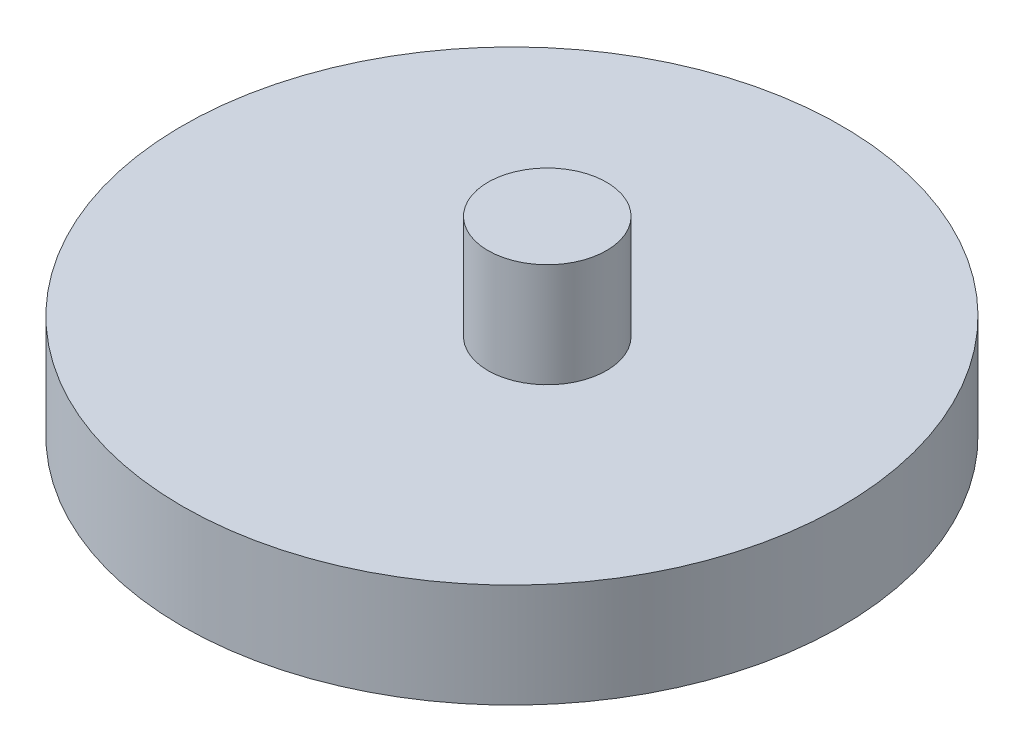
from build123d import *

# Parameters (mm, degrees)
SKETCH1_R           = 20.1295
BOSS_EXTRUDE1_DEPTH = 6.35
SKETCH2_R           = 3.6195
BOSS_EXTRUDE2_DEPTH = 6.35


with BuildPart() as part:
    # Sketch1 → Boss-Extrude1 (new body)
    with BuildSketch(Plane(origin=(0, 0, 0), x_dir=(1, 0, 0), z_dir=(0, 1, 0))):
        with Locations(Location((0, 0, 0), (0, 0, 270))):
            Circle(SKETCH1_R)
    extrude(amount=BOSS_EXTRUDE1_DEPTH)

    # Sketch2 → Boss-Extrude2 (add)
    with BuildSketch(Plane(origin=(0, 6.35, 0), x_dir=(1, 0, 0), z_dir=(0, 1, 0))):
        with Locations(Location((2.159, 0, 0), (0, 0, 270))):
            Circle(SKETCH2_R)
    extrude(amount=BOSS_EXTRUDE2_DEPTH)


solid = part.part
